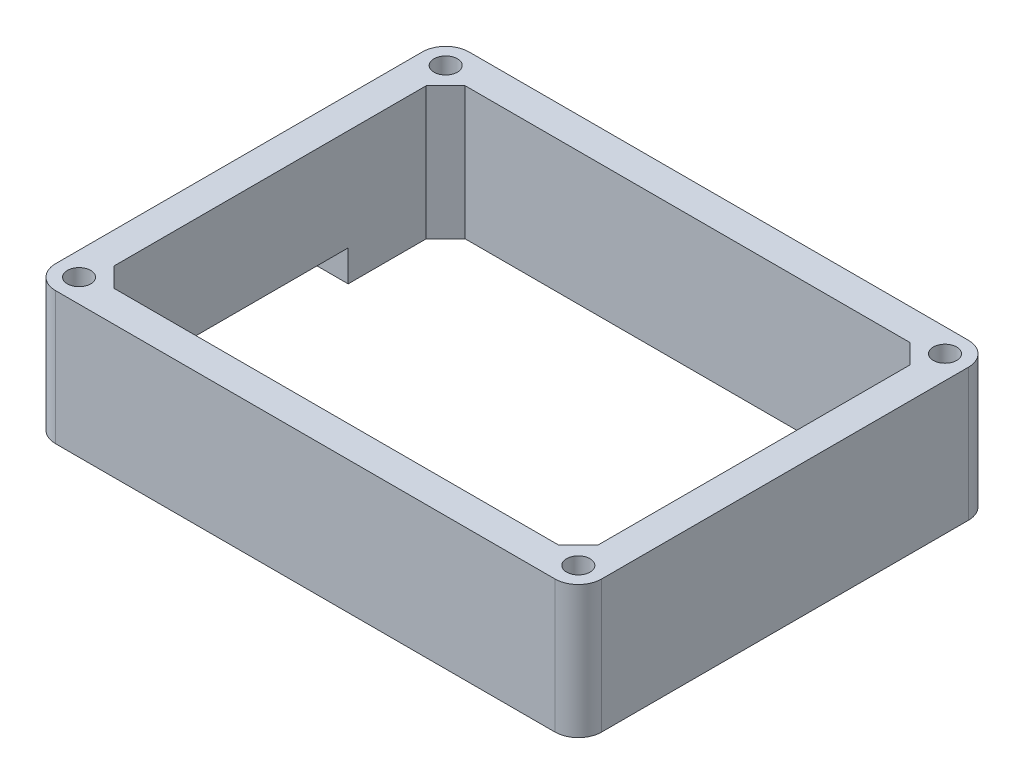
from build123d import *

# Parameters (mm, degrees)
SKETCH1_R           = 1.5
BOSS_EXTRUDE1_DEPTH = 17
SKETCH2_W           = 20
SKETCH2_H           = 4
CUT_EXTRUDE1_DEPTH  = 4


with BuildPart() as part:
    # Sketch1 → Boss-Extrude1 (new body)
    with BuildSketch(Plane(origin=(0, 0, 0), x_dir=(1, 0, 0), z_dir=(0, 1, 0))):
        with BuildLine():
            Line((-3, 0), (-67, 0))
            ThreePointArc((-67, 0), (-69.121320344, 0.878679656), (-70, 3))
            Line((-70, 3), (-70, 50))
            ThreePointArc((-70, 50), (-69.121320344, 52.121320344), (-67, 53))
            Line((-67, 53), (-3, 53))
            ThreePointArc((-3, 53), (-0.878679656, 52.121320344), (0, 50))
            Line((0, 50), (0, 3))
            ThreePointArc((0, 3), (-0.878679656, 0.878679656), (-3, 0))
        make_face()
        with Locations(Location((-67, 50, 0), (0, 0, 270))):
            Circle(SKETCH1_R, mode=Mode.SUBTRACT)
        with Locations(Location((-3, 50, 0), (0, 0, 90))):
            Circle(SKETCH1_R, mode=Mode.SUBTRACT)
        with Locations(Location((-3, 3, 0), (0, 0, 270))):
            Circle(SKETCH1_R, mode=Mode.SUBTRACT)
        with Locations(Location((-67, 3, 0), (0, 0, 90))):
            Circle(SKETCH1_R, mode=Mode.SUBTRACT)
        Polygon((-66, 46.5), (-63.5, 49), (-6.5, 49), (-4, 46.5), (-4, 6.5), (-6.5, 4), (-63.5, 4), (-66, 6.5), align=None, mode=Mode.SUBTRACT)
    extrude(amount=BOSS_EXTRUDE1_DEPTH)

    # Sketch2 → Cut-Extrude1 (cut)
    with BuildSketch(Plane.ZY.offset(70)):
        with Locations((-26.5, 2)):
            Rectangle(SKETCH2_W, SKETCH2_H)
    extrude(amount=-CUT_EXTRUDE1_DEPTH, mode=Mode.SUBTRACT)


solid = part.part
